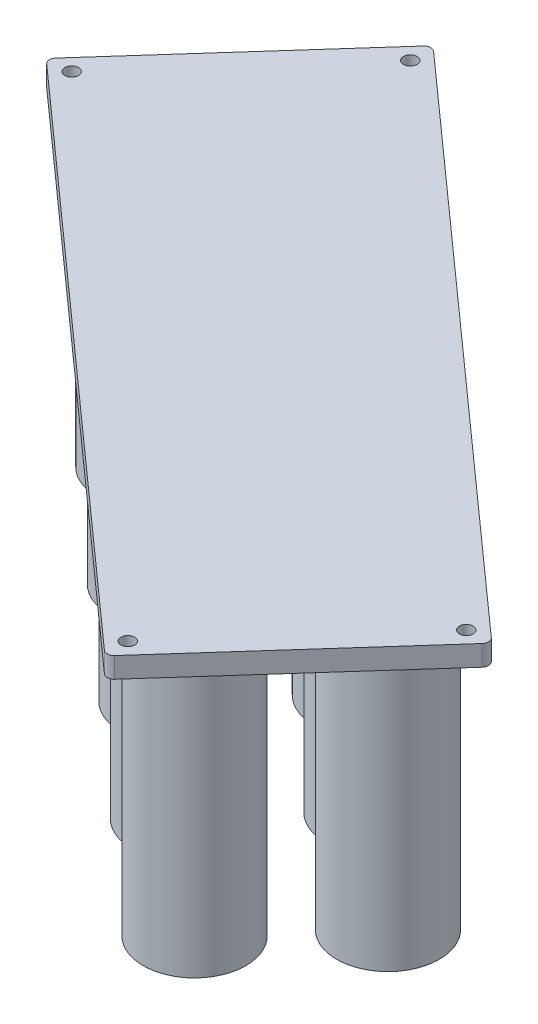
from build123d import *

# Parameters (mm, degrees)
EXTRUDE_1_DEPTH       = 3
SKETCH_2_W            = 7.5
SKETCH_2_H            = 30
SKETCH_3_W            = 7.5
SKETCH_3_H            = 30
SKETCH_4_W            = 7.5
SKETCH_4_H            = 30
SKETCH_5_W            = 7.5
SKETCH_5_H            = 30
SKETCH_6_W            = 7.5
SKETCH_6_H            = 30
SKETCH_7_W            = 7.5
SKETCH_7_H            = 30
SKETCH_8_W            = 7.5
SKETCH_8_H            = 30
SKETCH_9_W            = 7.5
SKETCH_9_H            = 30
SKETCH_10_W           = 7.5
SKETCH_10_H           = 30
SKETCH_11_W           = 7.5
SKETCH_11_H           = 30
HOLE_WIZARD_2_0_2_1_D = 2
FILLET_1_R            = 1
EXTRUDE_START         = 12
SKETCH_14_R           = 7.5
EXTRUDE_2_DEPTH       = 12


with BuildPart() as part:
    # 草图1 → 凸台-拉伸1 (new body)
    with BuildSketch(Plane.XZ.offset(9.693825789)):
        Polygon((-36.617689836, 41.909926554), (-9.984344221, 12.065917083), (69.848381115, 83.310116605), (43.215035499, 113.154126076), align=None)
    extrude(amount=-EXTRUDE_1_DEPTH)

    # 草图2 → 旋转1 (revolve)
    with BuildSketch(Plane(origin=(0, 0, 68.132775199), x_dir=(-1, 0, 0), z_dir=(0, 0, -1)), mode=Mode.PRIVATE) as revolve_1_sk:
        with Locations((-41.57263666, -24.693825789)):
            Rectangle(SKETCH_2_W, SKETCH_2_H)
    revolve(revolve_1_sk.sketch.rotate(Axis((37.82263666, -39.693825789, 68.132775199), (0, 1, 0)), 270), axis=Axis((37.82263666, -39.693825789, 68.132775199), (0, 1, 0)))

    # 草图3 → 旋转2 (revolve)
    with BuildSketch(Plane(origin=(0, 0, 83.054779935), x_dir=(-1, 0, 0), z_dir=(0, 0, -1)), mode=Mode.PRIVATE) as revolve_2_sk:
        with Locations((-28.255963852, -24.693825789)):
            Rectangle(SKETCH_3_W, SKETCH_3_H)
    revolve(revolve_2_sk.sketch.rotate(Axis((24.505963852, -39.693825789, 83.054779935), (0, 1, 0)), 270), axis=Axis((24.505963852, -39.693825789, 83.054779935), (0, 1, 0)))

    # 草图4 → 旋转3 (revolve)
    with BuildSketch(Plane(origin=(0, 0, 97.037286383), x_dir=(-1, 0, 0), z_dir=(0, 0, -1)), mode=Mode.PRIVATE) as revolve_3_sk:
        with Locations((-43.924068825, -24.693825789)):
            Rectangle(SKETCH_4_W, SKETCH_4_H)
    revolve(revolve_3_sk.sketch.rotate(Axis((40.174068825, -39.693825789, 97.037286383), (0, 1, 0)), 270), axis=Axis((40.174068825, -39.693825789, 97.037286383), (0, 1, 0)))

    # 草图5 → 旋转4 (revolve)
    with BuildSketch(Plane(origin=(0, 0, 82.115281647), x_dir=(-1, 0, 0), z_dir=(0, 0, -1)), mode=Mode.PRIVATE) as revolve_4_sk:
        with Locations((-57.240741633, -24.693825789)):
            Rectangle(SKETCH_5_W, SKETCH_5_H)
    revolve(revolve_4_sk.sketch.rotate(Axis((53.490741633, -39.693825789, 82.115281647), (0, 1, 0)), 270), axis=Axis((53.490741633, -39.693825789, 82.115281647), (0, 1, 0)))

    # 草图6 → 旋转5 (revolve)
    with BuildSketch(Plane(origin=(0, 0, 69.072273487), x_dir=(-1, 0, 0), z_dir=(0, 0, -1)), mode=Mode.PRIVATE) as revolve_5_sk:
        with Locations((-12.58785888, -24.693825789)):
            Rectangle(SKETCH_6_W, SKETCH_6_H)
    revolve(revolve_5_sk.sketch.rotate(Axis((8.83785888, -39.693825789, 69.072273487), (0, 1, 0)), 270), axis=Axis((8.83785888, -39.693825789, 69.072273487), (0, 1, 0)))

    # 草图7 → 旋转6 (revolve)
    with BuildSketch(Plane(origin=(0, 0, 55.089767038), x_dir=(-1, 0, 0), z_dir=(0, 0, -1)), mode=Mode.PRIVATE) as revolve_6_sk:
        with Locations((3.080246092, -24.693825789)):
            Rectangle(SKETCH_7_W, SKETCH_7_H)
    revolve(revolve_6_sk.sketch.rotate(Axis((-6.830246092, -39.693825789, 55.089767038), (0, 1, 0)), 270), axis=Axis((-6.830246092, -39.693825789, 55.089767038), (0, 1, 0)))

    # 草图8 → 旋转7 (revolve)
    with BuildSketch(Plane(origin=(0, 0, 41.10726059), x_dir=(-1, 0, 0), z_dir=(0, 0, -1)), mode=Mode.PRIVATE) as revolve_7_sk:
        with Locations((18.748351065, -24.693825789)):
            Rectangle(SKETCH_8_W, SKETCH_8_H)
    revolve(revolve_7_sk.sketch.rotate(Axis((-22.498351065, -39.693825789, 41.10726059), (0, 1, 0)), 270), axis=Axis((-22.498351065, -39.693825789, 41.10726059), (0, 1, 0)))

    # 草图9 → 旋转8 (revolve)
    with BuildSketch(Plane(origin=(0, 0, 54.150268751), x_dir=(-1, 0, 0), z_dir=(0, 0, -1)), mode=Mode.PRIVATE) as revolve_8_sk:
        with Locations((-25.904531688, -24.693825789)):
            Rectangle(SKETCH_9_W, SKETCH_9_H)
    revolve(revolve_8_sk.sketch.rotate(Axis((22.154531688, -39.693825789, 54.150268751), (0, 1, 0)), 270), axis=Axis((22.154531688, -39.693825789, 54.150268751), (0, 1, 0)))

    # 草图10 → 旋转9 (revolve)
    with BuildSketch(Plane(origin=(0, 0, 40.167762303), x_dir=(-1, 0, 0), z_dir=(0, 0, -1)), mode=Mode.PRIVATE) as revolve_9_sk:
        with Locations((-10.236426715, -24.693825789)):
            Rectangle(SKETCH_10_W, SKETCH_10_H)
    revolve(revolve_9_sk.sketch.rotate(Axis((6.486426715, -39.693825789, 40.167762303), (0, 1, 0)), 270), axis=Axis((6.486426715, -39.693825789, 40.167762303), (0, 1, 0)))

    # 草图11 → 旋转10 (revolve)
    with BuildSketch(Plane(origin=(0, 0, 26.185255855), x_dir=(-1, 0, 0), z_dir=(0, 0, -1)), mode=Mode.PRIVATE) as revolve_10_sk:
        with Locations((5.431678257, -24.693825789)):
            Rectangle(SKETCH_11_W, SKETCH_11_H)
    revolve(revolve_10_sk.sketch.rotate(Axis((-9.181678257, -39.693825789, 26.185255855), (0, 1, 0)), 270), axis=Axis((-9.181678257, -39.693825789, 26.185255855), (0, 1, 0)))

    # Ø2.0 (2) 直径孔1 (through all)
    with Locations(Plane(origin=(0, -9.693825789, 0), x_dir=(-1, 0, 0), z_dir=(0, -1, 0))):
        with Locations((-43.014369008, -109.624291383), (9.78367773, -15.595751776), (33.087855144, -41.709260063), (-66.318546422, -83.510783096)):
            Hole(HOLE_WIZARD_2_0_2_1_D / 2)

    # 圆角1
    fillet_1_edges = [part.edges().sort_by_distance(p)[0] for p in [
        (43.215035499, -8.193825789, 113.154126076),
        (69.848381115, -8.193825789, 83.310116605),
        (-9.984344221, -8.193825789, 12.065917083),
        (-36.617689836, -8.193825789, 41.909926554),
    ]]
    fillet(fillet_1_edges, radius=FILLET_1_R)

    # 草图14 → 凸台-拉伸2 (add)
    with BuildSketch(Plane.XZ.offset(39.693825789).offset(EXTRUDE_START)):
        with Locations(Location((40.174068825, 97.037286383, 0), (0, 0, 270))):
            Circle(SKETCH_14_R)
        with Locations(Location((24.505963852, 83.054779935, 0), (0, 0, 270))):
            Circle(SKETCH_14_R)
        with Locations(Location((8.83785888, 69.072273487, 0), (0, 0, 270))):
            Circle(SKETCH_14_R)
        with Locations(Location((-6.830246092, 55.089767038, 0), (0, 0, 270))):
            Circle(SKETCH_14_R)
        with Locations(Location((-22.498351065, 41.10726059, 0), (0, 0, 270))):
            Circle(SKETCH_14_R)
        with Locations(Location((-9.181678257, 26.185255855, 0), (0, 0, 270))):
            Circle(SKETCH_14_R)
        with Locations(Location((6.486426715, 40.167762303, 0), (0, 0, 270))):
            Circle(SKETCH_14_R)
        with Locations(Location((22.154531688, 54.150268751, 0), (0, 0, 270))):
            Circle(SKETCH_14_R)
        with Locations(Location((37.82263666, 68.132775199, 0), (0, 0, 270))):
            Circle(SKETCH_14_R)
        with Locations(Location((53.490741633, 82.115281647, 0), (0, 0, 270))):
            Circle(SKETCH_14_R)
    extrude(amount=-EXTRUDE_2_DEPTH)


solid = part.part
